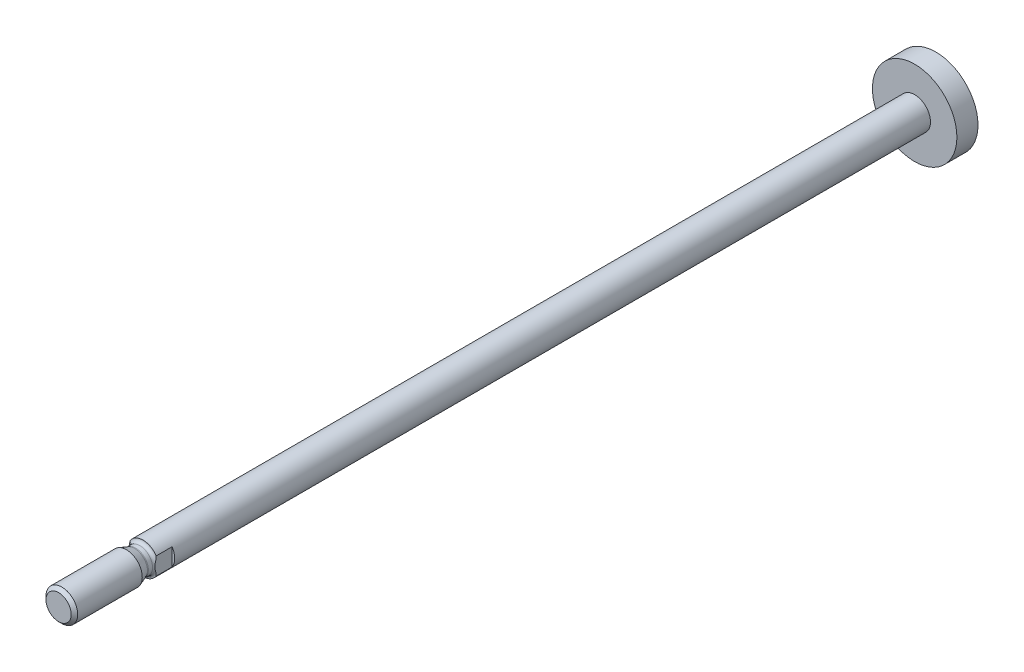
from build123d import *

# Parameters (mm, degrees)
CUT_EXTRUDE1_DEPTH = 4


with BuildPart() as part:
    # Sketch1 → Revolve1 (revolve)
    with BuildSketch(Plane(origin=(0, 0, 0), x_dir=(0, 0, -1), z_dir=(1, 0, 0))):
        Polygon((-5, 0), (-5, 3), (141.2, 3), (141.2, 8), (145.2, 8), (145.2, 0), align=None)
    revolve(axis=Axis((0, 0, -145.2), (0, 0, 1)))

    # Sketch2 → Revolve2 (revolve)
    with BuildSketch(Plane(origin=(0, 0, 0), x_dir=(0, 0, -1), z_dir=(1, 0, 0))):
        with BuildLine():
            Line((-21, 0), (-21, 2.3865))
            Line((-21, 2.3865), (-20.3865, 3))
            Line((-20.3865, 3), (-8.148486452, 3))
            Line((-8.148486452, 3), (-6.599415898, 2.436184428))
            ThreePointArc((-6.599415898, 2.436184428), (-6.498392718, 2.409115348), (-6.394203812, 2.4))
            Line((-6.394203812, 2.4), (-5.6, 2.4))
            ThreePointArc((-5.6, 2.4), (-5.175735931, 2.575735931), (-5, 3))
            Line((-5, 3), (-4, 3))
            Line((-4, 3), (-4, 0))
            Line((-4, 0), (-21, 0))
        make_face()
    revolve(axis=Axis((0, 0, 4), (0, 0, 1)))

    # Sketch3 → Cut-Extrude1 (cut)
    with BuildSketch(Plane.XY.offset(2)):
        Polygon((-5, 10), (-5, -5), (-2.5, -5), (-2.5, 5), (2.5, 5), (2.5, -5), (5, -5), (5, 10), align=None)
    extrude(amount=CUT_EXTRUDE1_DEPTH, mode=Mode.SUBTRACT)


solid = part.part
